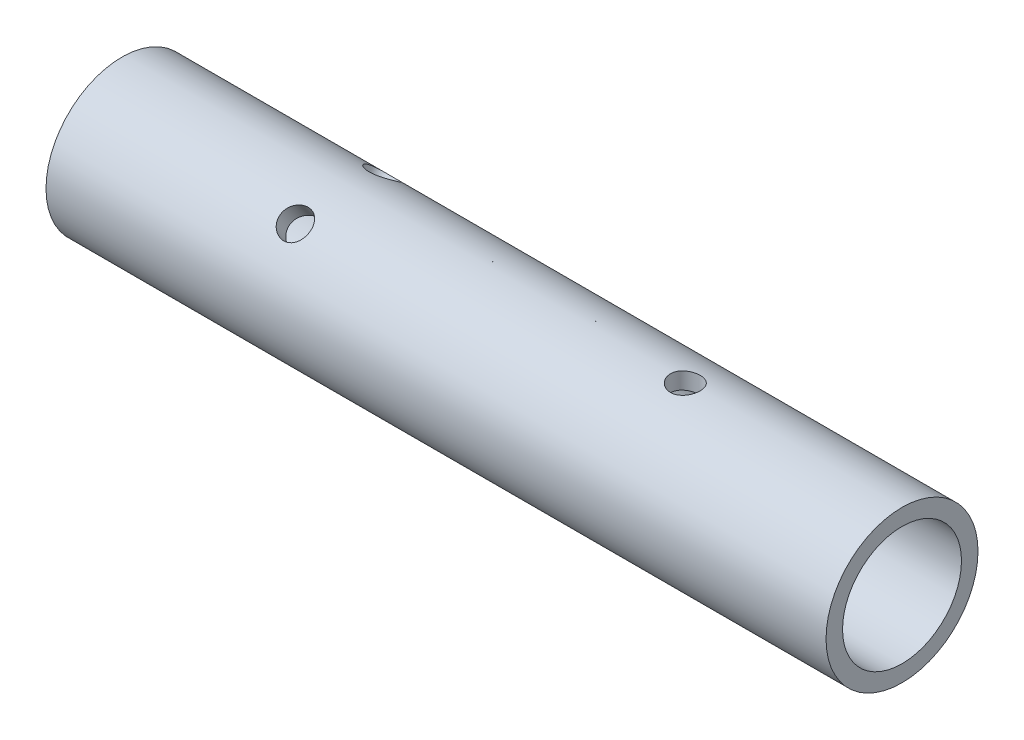
from build123d import *

# Parameters (mm, degrees)
SKETCH1_R               = 16.7005
SKETCH1_R_2             = 13.0683
BOSS_EXTRUDE1_DEPTH     = 254
CUT_EXTRUDE2_DEPTH      = 256.095694594
CUT_EXTRUDE2_DEPTH_BACK = 256.095694594
SKETCH3_R               = 3.2639
SKETCH4_R               = 3.2639
CUT_EXTRUDE3_DEPTH      = 256.095694707
CUT_EXTRUDE4_START      = -79.375
SKETCH5_R               = 16.7005
CUT_EXTRUDE4_DEPTH      = 79.375
SKETCH7_R               = 16.7005
CUT_EXTRUDE6_DEPTH      = 3.175


with BuildPart() as part:
    # Sketch1 → Boss-Extrude1 (new body)
    with BuildSketch(Plane(origin=(0, 0, 0), x_dir=(0, 0, -1), z_dir=(1, 0, 0))):
        Circle(SKETCH1_R)
        Circle(SKETCH1_R_2, mode=Mode.SUBTRACT)
    extrude(amount=BOSS_EXTRUDE1_DEPTH)

    # Sketch3 → Cut-Extrude2 (cut, two sides: drawn at the far end of the back side and taken through both)
    with BuildSketch(Plane(origin=(0, 0, 0), x_dir=(1, 0, 0), z_dir=(0, 1, 0)).offset(-CUT_EXTRUDE2_DEPTH_BACK)):
        with Locations((127, 0)):
            Circle(SKETCH3_R)
    extrude(amount=CUT_EXTRUDE2_DEPTH + CUT_EXTRUDE2_DEPTH_BACK, mode=Mode.SUBTRACT)

    # Sketch4 → Cut-Extrude3 (cut, symmetric)
    with BuildSketch(Plane(origin=(0, 0, 0), x_dir=(-1, 0, 0), z_dir=(0, 0.819152044288991, -0.5735764363510473))):
        with Locations((-203.2, 0)):
            Circle(SKETCH4_R)
        with Locations((-50.8, 0)):
            Circle(SKETCH4_R)
    cut_extrude3 = extrude(amount=CUT_EXTRUDE3_DEPTH, both=True, mode=Mode.SUBTRACT)

    # Sketch5 → Cut-Extrude4 (cut)
    with BuildSketch(Plane(origin=(254, 0, 0), x_dir=(0, 0, -1), z_dir=(1, 0, 0)).offset(CUT_EXTRUDE4_START)):
        Circle(SKETCH5_R)
    extrude(amount=CUT_EXTRUDE4_DEPTH, mode=Mode.SUBTRACT)

    # Mirror1: Cut-Extrude3 across plane
    add(cut_extrude3.mirror(Plane.XY), mode=Mode.SUBTRACT)

    # Sketch7 → Cut-Extrude6 (cut)
    with BuildSketch(Plane.ZY):
        Circle(SKETCH7_R)
    extrude(amount=-CUT_EXTRUDE6_DEPTH, mode=Mode.SUBTRACT)


solid = part.part
